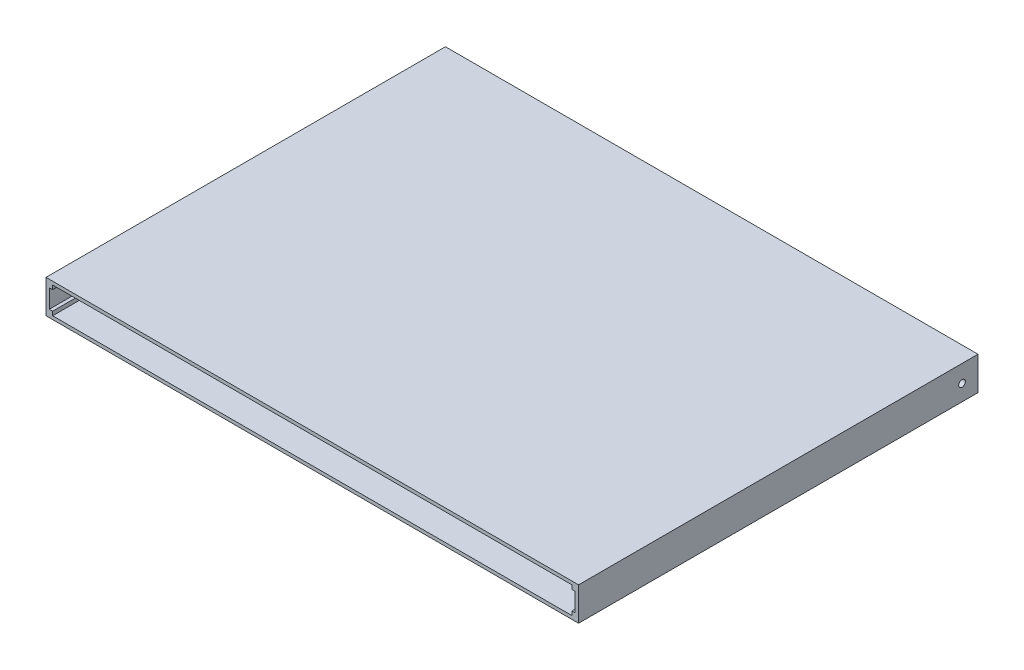
from build123d import *

# Parameters (mm, degrees)
SKETCH1_W           = 508
SKETCH1_H           = 381
BOSS_EXTRUDE1_DEPTH = 31.75
SKETCH2_W           = 501.65
SKETCH2_H           = 25.4
CUT_EXTRUDE1_DEPTH  = 342.9
SKETCH3_W           = 3.175
SKETCH3_H           = 3.81
BOSS_EXTRUDE2_DEPTH = 35.56
SKETCH4_R           = 3.175
CUT_EXTRUDE2_DEPTH  = 25.4
CUT_EXTRUDE3_START  = -482.6
SKETCH4_2_R         = 3.175
CUT_EXTRUDE3_DEPTH  = 25.4


with BuildPart() as part:
    # Sketch1 → Boss-Extrude1 (new body)
    with BuildSketch(Plane(origin=(0, 0, 0), x_dir=(1, 0, 0), z_dir=(0, 1, 0))):
        Rectangle(SKETCH1_W, SKETCH1_H)
    extrude(amount=BOSS_EXTRUDE1_DEPTH)

    # Sketch2 → Cut-Extrude1 (cut)
    with BuildSketch(Plane.XY.offset(190.5)):
        with Locations((0, 15.875)):
            Rectangle(SKETCH2_W, SKETCH2_H)
    extrude(amount=-CUT_EXTRUDE1_DEPTH, mode=Mode.SUBTRACT)

    # Sketch3 → Boss-Extrude2 (add)
    with BuildSketch(Plane.XY.offset(190.5)):
        with Locations((-249.2375, 26.67)):
            Rectangle(SKETCH3_W, SKETCH3_H)
        with Locations((-249.2375, 5.08)):
            Rectangle(SKETCH3_W, SKETCH3_H)
        with Locations((249.2375, 5.08)):
            Rectangle(SKETCH3_W, SKETCH3_H)
        with Locations((249.2375, 26.67)):
            Rectangle(SKETCH3_W, SKETCH3_H)
    extrude(amount=-BOSS_EXTRUDE2_DEPTH)

    # Sketch4 → Cut-Extrude2 (cut)
    with BuildSketch(Plane.ZY.offset(254)):
        with Locations((-175.26, 15.24)):
            Circle(SKETCH4_R)
    extrude(amount=-CUT_EXTRUDE2_DEPTH, mode=Mode.SUBTRACT)

    # Sketch4<2> → Cut-Extrude3 (cut)
    with BuildSketch(Plane.ZY.offset(254).offset(CUT_EXTRUDE3_START)):
        with Locations((-175.26, 15.24)):
            Circle(SKETCH4_2_R)
    extrude(amount=-CUT_EXTRUDE3_DEPTH, mode=Mode.SUBTRACT)


solid = part.part
